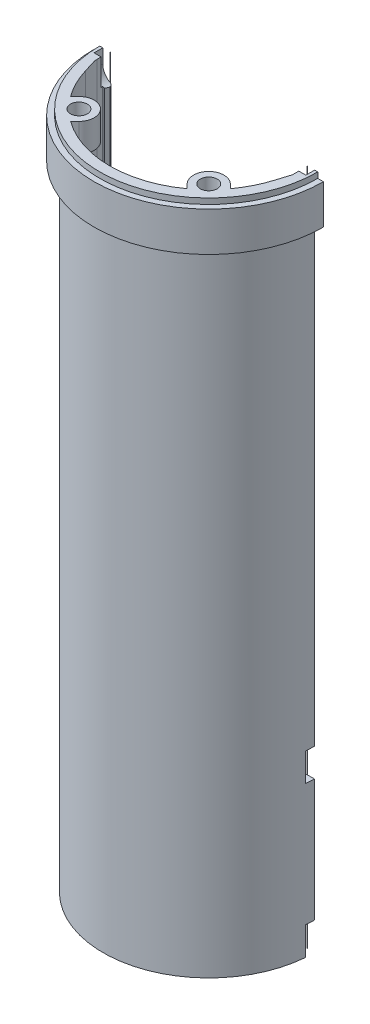
from build123d import *
from build123d.topology import SkipClean

# Parameters (mm, degrees)
SKETCH1_W           = 1.6
SKETCH1_H           = 7.964
REVOLVE1_ANGLE      = 180
SKETCH14_W          = 1
SKETCH14_H          = 1
CUT_EXTRUDE1_DEPTH  = 186.929464701
BOSS_EXTRUDE1_DEPTH = 120
SKETCH18_W          = 1.2
SKETCH18_H          = 5
CUT_EXTRUDE2_DEPTH  = 1.55
BOSS_EXTRUDE2_START = -5
BOSS_EXTRUDE2_DEPTH = 5
CUT_EXTRUDE3_START  = -5
CUT_EXTRUDE3_DEPTH  = 5
CUT_EXTRUDE4_DEPTH  = 5


with BuildPart() as part:
    # Sketch1 → Revolve1 (revolve)
    with BuildSketch(Plane.XY):
        Polygon((-102.762, -166.6938), (-101.562, -166.6938), (-101.562, -54.6578), (-101.562, -46.6938), (-102.762, -46.6938), align=None)
        with Locations((-100.762, -50.6758)):
            Rectangle(SKETCH1_W, SKETCH1_H)
    revolve(axis=Axis((-120.262, -49.1938, 0), (0, -1, 0)), revolution_arc=REVOLVE1_ANGLE)

    # Sketch14 → Cut-Revolve1 (revolve, cut)
    with BuildSketch(Plane(origin=(0, 0, 0), x_dir=(-1, 0, 0), z_dir=(0, 0, -1))):
        with Locations((140.062, -47.1938)):
            Rectangle(SKETCH14_W, SKETCH14_H)
    revolve(axis=Axis((-120.262, -49.1938, 0), (0, -1, 0)), mode=Mode.SUBTRACT)

    # Sketch16 → Cut-Extrude1 (cut, through all)
    with BuildSketch(Plane.XZ.offset(166.6938)):
        with BuildLine():
            ThreePointArc((-137.00671868, 5.085705096), (-137.469221704, 3.187714109), (-137.717300055, 1.25))
            Line((-137.717300055, 1.25), (-137.137, 1.25))
            Line((-137.137, 1.25), (-137.00671868, 5.085705096))
        make_face()
        with BuildLine():
            Line((-137.762, 2.298239247), (-137.762, 1.25))
            Line((-137.762, 1.25), (-137.717300055, 1.25))
            ThreePointArc((-137.717300055, 1.25), (-137.469221704, 3.187714109), (-137.00671868, 5.085705096))
            add(Edge.make_bspline(
                [(-137.762, 2.298239247), (-137.762, 2.899633162), (-137.762, 2.598936204), (-137.00671868, 5.085705096)],
                knots=[0, 0, 0, 0, 1, 1, 1, 1], degree=3))
        make_face()
        with BuildLine():
            Line((-137.762, 1.25), (-137.762, 0))
            ThreePointArc((-137.762, 0), (-137.750821443, 0.625399489), (-137.717300055, 1.25))
            Line((-137.717300055, 1.25), (-137.762, 1.25))
        make_face()
        with BuildLine():
            ThreePointArc((-137.717300055, 1.25), (-137.750821443, 0.625399489), (-137.762, 0))
            Line((-137.762, 0), (-136.512, 0))
            Line((-136.512, 0), (-136.512, 1.25))
            Line((-136.512, 1.25), (-137.137, 1.25))
            Line((-137.137, 1.25), (-137.717300055, 1.25))
        make_face()
    cut_extrude1 = extrude(amount=-CUT_EXTRUDE1_DEPTH, mode=Mode.SUBTRACT)

    # Sketch17 → Boss-Extrude1 (add)
    with BuildSketch(Plane.XZ.offset(166.6938)):
        with BuildLine():
            Line((-137.262, 0.494310199), (-137.462961894, 1.244310199))
            Line((-137.462961894, 1.244310199), (-137.762, 1.244310199))
            Line((-137.762, 1.244310199), (-137.762, -0.005689801))
            ThreePointArc((-137.762, -0.005689801), (-137.408446609, 0.140756808), (-137.262, 0.494310199))
        make_face()
    boss_extrude1 = extrude(amount=-BOSS_EXTRUDE1_DEPTH)

    # Mirror1: Cut-Extrude1, Boss-Extrude1 across plane
    add(cut_extrude1.mirror(Plane(origin=(-120.262, 0, 0), x_dir=(0, 0, 1), z_dir=(1, 0, 0))), mode=Mode.SUBTRACT)
    add(boss_extrude1.mirror(Plane(origin=(-120.262, 0, 0), x_dir=(0, 0, 1), z_dir=(1, 0, 0))))

    # Sketch18 → Cut-Extrude2 (cut)
    with BuildSketch(Plane(origin=(0, 0, 0), x_dir=(-1, 0, 0), z_dir=(0, 0, -1))):
        with Locations((138.362, -164.1938)):
            Rectangle(SKETCH18_W, SKETCH18_H)
        with BuildLine():
            Line((137.762, -166.6938), (137.762, -161.6938))
            Line((137.762, -161.6938), (136.512, -161.6938))
            ThreePointArc((136.512, -161.6938), (134.012, -164.19379996), (136.51199992, -166.6938))
            Line((136.51199992, -166.6938), (137.762, -166.6938))
        make_face()
        with BuildLine():
            Line((137.762, -140.041), (137.762, -135.041))
            Line((137.762, -135.041), (136.512, -135.041))
            ThreePointArc((136.512, -135.041), (134.012, -137.541), (136.512, -140.041))
            Line((136.512, -140.041), (137.762, -140.041))
        make_face()
        with Locations((138.362, -137.541)):
            Rectangle(SKETCH18_W, SKETCH18_H)
        with BuildLine():
            ThreePointArc((137.762, -51.358863509), (138.677063509, -50.4438), (139.012, -49.1938))
            ThreePointArc((139.012, -49.1938), (138.677063509, -47.9438), (137.762, -47.028736491))
            Line((137.762, -47.028736491), (137.762, -51.358863509))
        make_face()
        with BuildLine():
            Line((137.762, -51.358863509), (137.762, -47.028736491))
            ThreePointArc((137.762, -47.028736491), (137.159047613, -46.778985434), (136.512, -46.6938))
            ThreePointArc((136.512, -46.6938), (134.012, -49.1938), (136.512, -51.6938))
            ThreePointArc((136.512, -51.6938), (137.159047613, -51.608614566), (137.762, -51.358863509))
        make_face()
        with BuildLine():
            ThreePointArc((137.762, -51.358863509), (138.677063509, -50.4438), (139.012, -49.1938))
            ThreePointArc((139.012, -49.1938), (138.677063509, -47.9438), (137.762, -47.028736491))
            Line((137.762, -47.028736491), (137.762, -51.358863509))
        make_face()
        with BuildLine():
            Line((137.762, -51.358863509), (137.762, -47.028736491))
            ThreePointArc((137.762, -47.028736491), (137.159047613, -46.778985434), (136.512, -46.6938))
            ThreePointArc((136.512, -46.6938), (134.012, -49.1938), (136.512, -51.6938))
            ThreePointArc((136.512, -51.6938), (137.159047613, -51.608614566), (137.762, -51.358863509))
        make_face()
        with BuildLine():
            ThreePointArc((137.762, -47.028736491), (138.677063509, -47.9438), (139.012, -49.1938))
            Line((139.012, -49.1938), (139.012, -46.6938))
            Line((139.012, -46.6938), (137.762, -46.6938))
            Line((137.762, -46.6938), (137.762, -47.028736491))
        make_face()
        with BuildLine():
            ThreePointArc((136.512, -46.6938), (137.159047613, -46.778985434), (137.762, -47.028736491))
            Line((137.762, -47.028736491), (137.762, -46.6938))
            Line((137.762, -46.6938), (136.512, -46.6938))
        make_face()
    cut_extrude2 = extrude(amount=-CUT_EXTRUDE2_DEPTH, mode=Mode.SUBTRACT)

    # Mirror2: Cut-Extrude2 across plane
    add(cut_extrude2.mirror(Plane(origin=(-120.262, 0, 0), x_dir=(0, 0, 1), z_dir=(1, 0, 0))), mode=Mode.SUBTRACT)

    # Sketch19 → Boss-Extrude2 (add)
    with BuildSketch(Plane(origin=(0, -46.6938, 0), x_dir=(1, 0, 0), z_dir=(0, 1, 0)).offset(BOSS_EXTRUDE2_START)):
        with BuildLine():
            Line((-130.579013063, -14.135389682), (-129.843296885, -13.399673503))
            ThreePointArc((-129.843296885, -13.399673503), (-129.843296885, -9.581296885), (-133.661673503, -9.581296885))
            Line((-133.661673503, -9.581296885), (-134.397389682, -10.317013063))
            ThreePointArc((-134.397389682, -10.317013063), (-133.832483939, -11.049523323), (-133.229661056, -11.75116023))
            ThreePointArc((-133.229661056, -11.75116023), (-131.883321366, -9.996202123), (-130.252485194, -11.490485194))
            ThreePointArc((-130.252485194, -11.490485194), (-130.788382646, -12.639618031), (-132.01316023, -12.967661056))
            ThreePointArc((-132.01316023, -12.967661056), (-131.311523323, -13.570483939), (-130.579013063, -14.135389682))
        make_face()
        with BuildLine():
            Line((-110.680703115, -13.399673503), (-109.944986937, -14.135389682))
            ThreePointArc((-109.944986937, -14.135389682), (-109.212476677, -13.570483939), (-108.51083977, -12.967661056))
            ThreePointArc((-108.51083977, -12.967661056), (-109.920647642, -10.526382646), (-107.271514806, -11.490485194))
            ThreePointArc((-107.271514806, -11.490485194), (-107.277231735, -11.621321366), (-107.294338944, -11.75116023))
            ThreePointArc((-107.294338944, -11.75116023), (-106.691516061, -11.049523323), (-106.126610318, -10.317013063))
            Line((-106.126610318, -10.317013063), (-106.862326497, -9.581296885))
            ThreePointArc((-106.862326497, -9.581296885), (-110.680703115, -9.581296885), (-110.680703115, -13.399673503))
        make_face()
    boss_extrude2 = extrude(amount=BOSS_EXTRUDE2_DEPTH)

    # Sketch20 → Cut-Extrude3 (cut)
    with SkipClean():  # the faces are left unmerged after this step: merging them gives an invalid solid
        with BuildSketch(Plane(origin=(0, -46.6938, 0), x_dir=(1, 0, 0), z_dir=(0, 1, 0)).offset(CUT_EXTRUDE3_START)):
            with BuildLine():
                ThreePointArc((-108.51083977, -12.967661056), (-107.887631329, -12.374368671), (-107.294338944, -11.75116023))
                ThreePointArc((-107.294338944, -11.75116023), (-107.277231735, -11.621321366), (-107.271514806, -11.490485194))
                ThreePointArc((-107.271514806, -11.490485194), (-109.920647642, -10.526382646), (-108.51083977, -12.967661056))
            make_face()
            with BuildLine():
                ThreePointArc((-108.51083977, -12.967661056), (-107.710854634, -12.551145366), (-107.294338944, -11.75116023))
                ThreePointArc((-107.294338944, -11.75116023), (-107.887631329, -12.374368671), (-108.51083977, -12.967661056))
            make_face()
            with BuildLine():
                ThreePointArc((-133.229661056, -11.75116023), (-132.636368671, -12.374368671), (-132.01316023, -12.967661056))
                ThreePointArc((-132.01316023, -12.967661056), (-130.788382646, -12.639618031), (-130.252485194, -11.490485194))
                ThreePointArc((-130.252485194, -11.490485194), (-131.883321366, -9.996202123), (-133.229661056, -11.75116023))
            make_face()
            with BuildLine():
                ThreePointArc((-133.229661056, -11.75116023), (-132.813145366, -12.551145366), (-132.01316023, -12.967661056))
                ThreePointArc((-132.01316023, -12.967661056), (-132.636368671, -12.374368671), (-133.229661056, -11.75116023))
            make_face()
            with BuildLine():
                ThreePointArc((-132.01316023, -12.967661056), (-132.636368671, -12.374368671), (-133.229661056, -11.75116023))
                ThreePointArc((-133.229661056, -11.75116023), (-130.691825023, -10.429825023), (-132.01316023, -12.967661056))
            make_face()
            with BuildLine():
                ThreePointArc((-108.51083977, -12.967661056), (-109.832174977, -10.429825023), (-107.294338944, -11.75116023))
                ThreePointArc((-107.294338944, -11.75116023), (-107.887631329, -12.374368671), (-108.51083977, -12.967661056))
            make_face()
        extrude(amount=CUT_EXTRUDE3_DEPTH, mode=Mode.SUBTRACT)

    # Mirror3: Boss-Extrude2 across plane
    with SkipClean():  # the faces are left unmerged after this step: merging them gives an invalid solid
        add(boss_extrude2.mirror(Plane.ZX.offset(-106.6938)))

    # Sketch21 → Cut-Extrude4 (cut)
    with SkipClean():  # the faces are left unmerged after this step: merging them gives an invalid solid
        with BuildSketch(Plane.XZ.offset(166.6938)):
            with BuildLine():
                ThreePointArc((-107.323684437, 11.783462581), (-107.887631329, 12.374368671), (-108.478537419, 12.938315563))
                ThreePointArc((-108.478537419, 12.938315563), (-109.914936786, 10.555266128), (-107.294338944, 11.490485194))
                ThreePointArc((-107.294338944, 11.490485194), (-107.301693626, 11.637706887), (-107.323684437, 11.783462581))
            make_face()
            with BuildLine():
                ThreePointArc((-107.323684437, 11.783462581), (-107.726993737, 12.535006263), (-108.478537419, 12.938315563))
                ThreePointArc((-108.478537419, 12.938315563), (-107.887631329, 12.374368671), (-107.323684437, 11.783462581))
            make_face()
            with BuildLine():
                ThreePointArc((-107.323684437, 11.783462581), (-107.887631329, 12.374368671), (-108.478537419, 12.938315563))
                ThreePointArc((-108.478537419, 12.938315563), (-109.914936786, 10.555266128), (-107.294338944, 11.490485194))
                ThreePointArc((-107.294338944, 11.490485194), (-107.301693626, 11.637706887), (-107.323684437, 11.783462581))
            make_face()
            with BuildLine():
                ThreePointArc((-107.323684437, 11.783462581), (-107.726993737, 12.535006263), (-108.478537419, 12.938315563))
                ThreePointArc((-108.478537419, 12.938315563), (-107.887631329, 12.374368671), (-107.323684437, 11.783462581))
            make_face()
            with BuildLine():
                ThreePointArc((-132.01316023, 12.967661056), (-130.691825023, 10.429825023), (-133.229661056, 11.75116023))
                ThreePointArc((-133.229661056, 11.75116023), (-132.636368671, 12.374368671), (-132.01316023, 12.967661056))
            make_face()
            with BuildLine():
                ThreePointArc((-132.01316023, 12.967661056), (-132.636368671, 12.374368671), (-133.229661056, 11.75116023))
                ThreePointArc((-133.229661056, 11.75116023), (-131.883321366, 9.996202123), (-130.252485194, 11.490485194))
                ThreePointArc((-130.252485194, 11.490485194), (-130.788382646, 12.639618031), (-132.01316023, 12.967661056))
            make_face()
            with BuildLine():
                ThreePointArc((-132.01316023, 12.967661056), (-132.813145366, 12.551145366), (-133.229661056, 11.75116023))
                ThreePointArc((-133.229661056, 11.75116023), (-132.636368671, 12.374368671), (-132.01316023, 12.967661056))
            make_face()
        extrude(amount=-CUT_EXTRUDE4_DEPTH, mode=Mode.SUBTRACT)


solid = part.part
